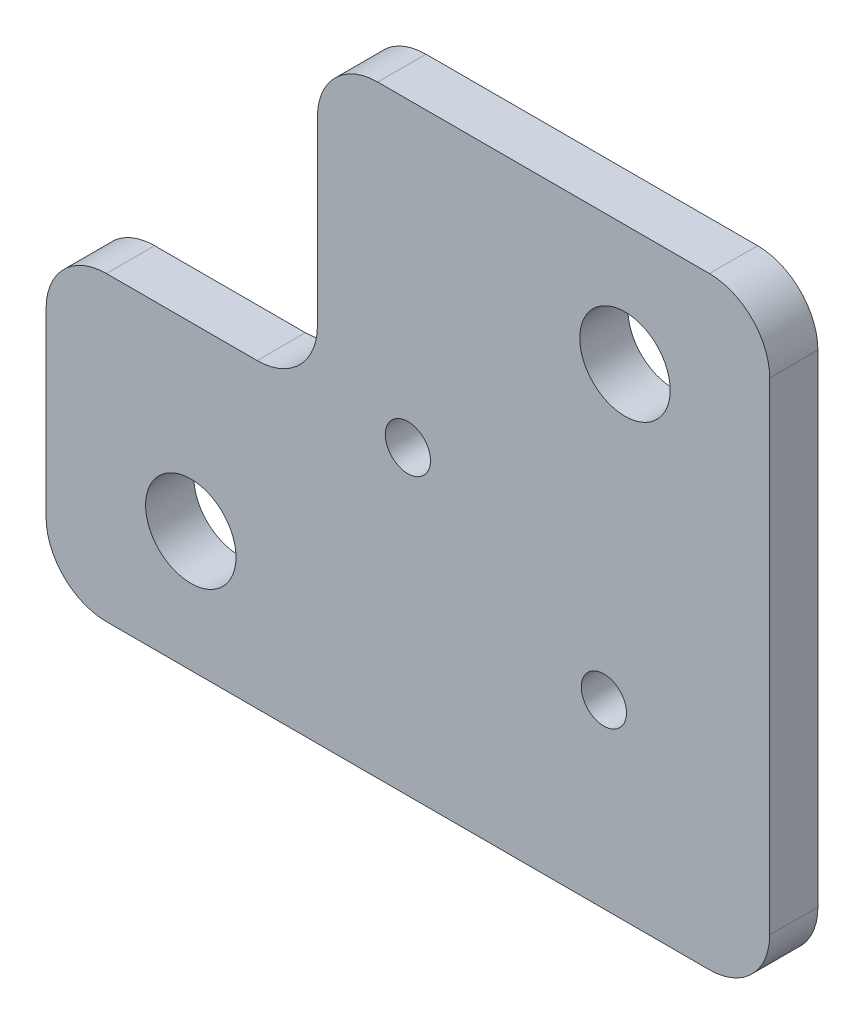
from build123d import *

# Parameters (mm, degrees)
SKETCH_1_W          = 12
SKETCH_1_H          = 10
EXTRUDE_1_DEPTH     = 0.8
CUT_EXTRUDE_1_REACH = 9.851
SKETCH_2_R          = 0.375
SKETCH_2_R_2        = 0.75
SKETCH_2_W          = 4.5
SKETCH_2_H          = 5
FILLET_1_R          = 1


with BuildPart() as part:
    # Эскиз1 → Бобышка-Вытянуть1 (new body)
    with BuildSketch(Plane.XY):
        Rectangle(SKETCH_1_W, SKETCH_1_H)
    extrude(amount=EXTRUDE_1_DEPTH)

    # Эскиз2 → Вырез-Вытянуть1 (cut, up to next)
    with BuildSketch(Plane.XY.offset(0.8), mode=Mode.PRIVATE) as cut_extrude_1_sk1:
        Circle(SKETCH_2_R)
    cut_extrude_1_tool1 = extrude(cut_extrude_1_sk1.sketch, amount=-CUT_EXTRUDE_1_REACH, mode=Mode.PRIVATE) & part.part
    # Эскиз2 → Вырез-Вытянуть1 (cut, up to next)
    with BuildSketch(Plane.XY.offset(0.8), mode=Mode.PRIVATE) as cut_extrude_1_sk2:
        with Locations((-3.6, -3)):
            Circle(SKETCH_2_R_2)
    cut_extrude_1_tool2 = extrude(cut_extrude_1_sk2.sketch, amount=-CUT_EXTRUDE_1_REACH, mode=Mode.PRIVATE) & part.part
    # Эскиз2 → Вырез-Вытянуть1 (cut, up to next)
    with BuildSketch(Plane.XY.offset(0.8), mode=Mode.PRIVATE) as cut_extrude_1_sk3:
        with Locations((3.6, 3)):
            Circle(SKETCH_2_R_2)
    cut_extrude_1_tool3 = extrude(cut_extrude_1_sk3.sketch, amount=-CUT_EXTRUDE_1_REACH, mode=Mode.PRIVATE) & part.part
    # Эскиз2 → Вырез-Вытянуть1 (cut, up to next)
    with BuildSketch(Plane.XY.offset(0.8), mode=Mode.PRIVATE) as cut_extrude_1_sk4:
        with Locations((3.25, -2)):
            Circle(SKETCH_2_R)
    cut_extrude_1_tool4 = extrude(cut_extrude_1_sk4.sketch, amount=-CUT_EXTRUDE_1_REACH, mode=Mode.PRIVATE) & part.part
    # Эскиз2 → Вырез-Вытянуть1 (cut, up to next)
    with BuildSketch(Plane.XY.offset(0.8), mode=Mode.PRIVATE) as cut_extrude_1_sk5:
        with Locations((-3.75, 2.5)):
            Rectangle(SKETCH_2_W, SKETCH_2_H)
    cut_extrude_1_tool5 = extrude(cut_extrude_1_sk5.sketch, amount=-CUT_EXTRUDE_1_REACH, mode=Mode.PRIVATE) & part.part
    add(cut_extrude_1_tool1.solids().sort_by_distance((0, 0, 0.8))[0], mode=Mode.SUBTRACT)
    add(cut_extrude_1_tool2.solids().sort_by_distance((-3.6, -3, 0.8))[0], mode=Mode.SUBTRACT)
    add(cut_extrude_1_tool3.solids().sort_by_distance((3.6, 3, 0.8))[0], mode=Mode.SUBTRACT)
    add(cut_extrude_1_tool4.solids().sort_by_distance((3.25, -2, 0.8))[0], mode=Mode.SUBTRACT)
    add(cut_extrude_1_tool5.solids().sort_by_distance((-3.75, 2.5, 0.8))[0], mode=Mode.SUBTRACT)

    # Скругление1
    fillet_1_edges = [part.edges().sort_by_distance(p)[0] for p in [
        (-6, 0, 0.4),
        (-1.5, 5, 0.4),
        (-1.5, 0, 0.4),
        (6, -5, 0.4),
        (-6, -5, 0.4),
        (6, 5, 0.4),
    ]]
    fillet(fillet_1_edges, radius=FILLET_1_R)


solid = part.part
